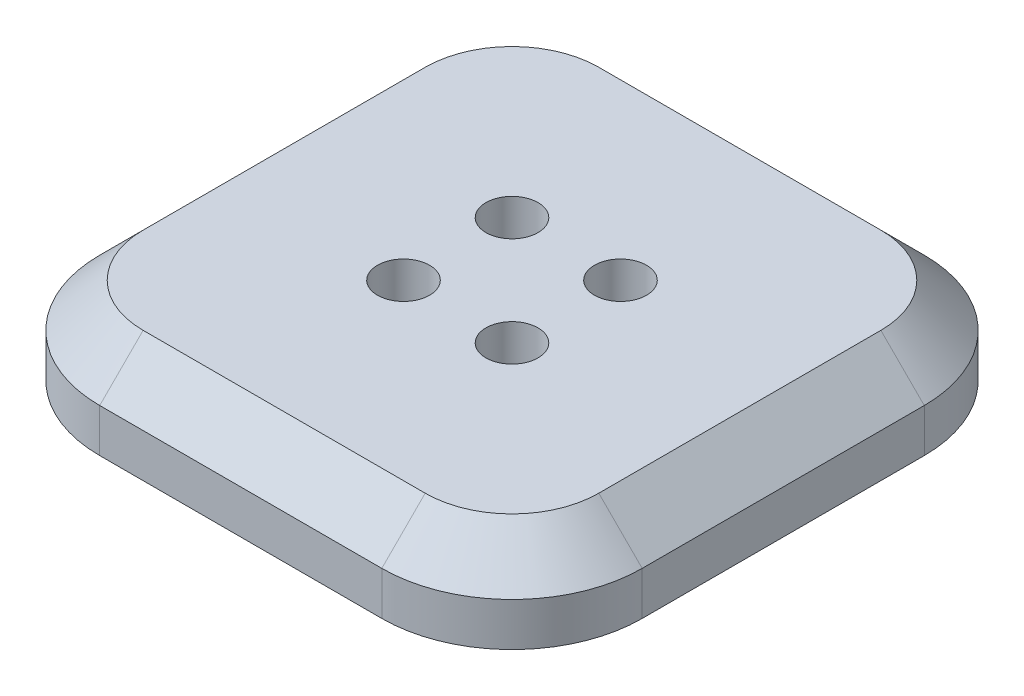
from build123d import *

# Parameters (mm, degrees)
SKETCH_1_W          = 125
SKETCH_1_H          = 125
EXTRUDE_1_DEPTH     = 20
FILLET_1_R          = 30
CHAMFER_1_SIZE      = 10
HOLE_WIZARD_1_D     = 12
HOLE_WIZARD_1_DEPTH = 10
HOLE_WIZARD_1_TIP   = 3.605163714
HOLE_WIZARD_2_D     = 12
HOLE_WIZARD_2_DEPTH = 10
HOLE_WIZARD_2_TIP   = 3.605163714


with BuildPart() as part:
    # 草圖1 → 擠出1 (new body)
    with BuildSketch(Plane(origin=(0, 0, 0), x_dir=(-1, 0, 0), z_dir=(0, 1, 0))):
        Rectangle(SKETCH_1_W, SKETCH_1_H)
    extrude(amount=EXTRUDE_1_DEPTH)

    # 圓角1
    fillet_1_edges = [part.edges().sort_by_distance(p)[0] for p in [
        (-62.5, 10, -62.5),
        (62.5, 10, -62.5),
        (62.5, 10, 62.5),
        (-62.5, 10, 62.5),
    ]]
    fillet(fillet_1_edges, radius=FILLET_1_R)

    # 倒角1
    chamfer_1_edges = [part.edges().sort_by_distance(p)[0] for p in [
        (0, 20, -62.5),
        (62.5, 20, 0),
        (-62.5, 20, 0),
        (0, 20, 62.5),
        (53.713203436, 20, 53.713203436),
        (-53.713203436, 20, -53.713203436),
        (-53.713203436, 20, 53.713203436),
        (53.713203436, 20, -53.713203436),
    ]]
    chamfer(chamfer_1_edges, length=CHAMFER_1_SIZE)

    # 孔1
    with Locations(Plane(origin=(0, 0, 0), x_dir=(-1, 0, 0), z_dir=(0, -1, 0))):
        with Locations((-37.5, -37.5), (37.5, -37.5), (37.5, 37.5), (-37.5, 37.5)):
            Hole(HOLE_WIZARD_1_D / 2, depth=HOLE_WIZARD_1_DEPTH)
            with Locations((0, 0, -(HOLE_WIZARD_1_DEPTH + HOLE_WIZARD_1_TIP / 2))):  # 118° drill point
                Cone(0, HOLE_WIZARD_1_D / 2, HOLE_WIZARD_1_TIP, mode=Mode.SUBTRACT)

    # 孔2
    with Locations(Plane(origin=(0, 20, 0), x_dir=(1, 0, 0), z_dir=(0, 1, 0))):
        with Locations((12.5, 12.5), (12.5, -12.5), (-12.5, -12.5), (-12.5, 12.5)):
            Hole(HOLE_WIZARD_2_D / 2, depth=HOLE_WIZARD_2_DEPTH)
            with Locations((0, 0, -(HOLE_WIZARD_2_DEPTH + HOLE_WIZARD_2_TIP / 2))):  # 118° drill point
                Cone(0, HOLE_WIZARD_2_D / 2, HOLE_WIZARD_2_TIP, mode=Mode.SUBTRACT)


solid = part.part
